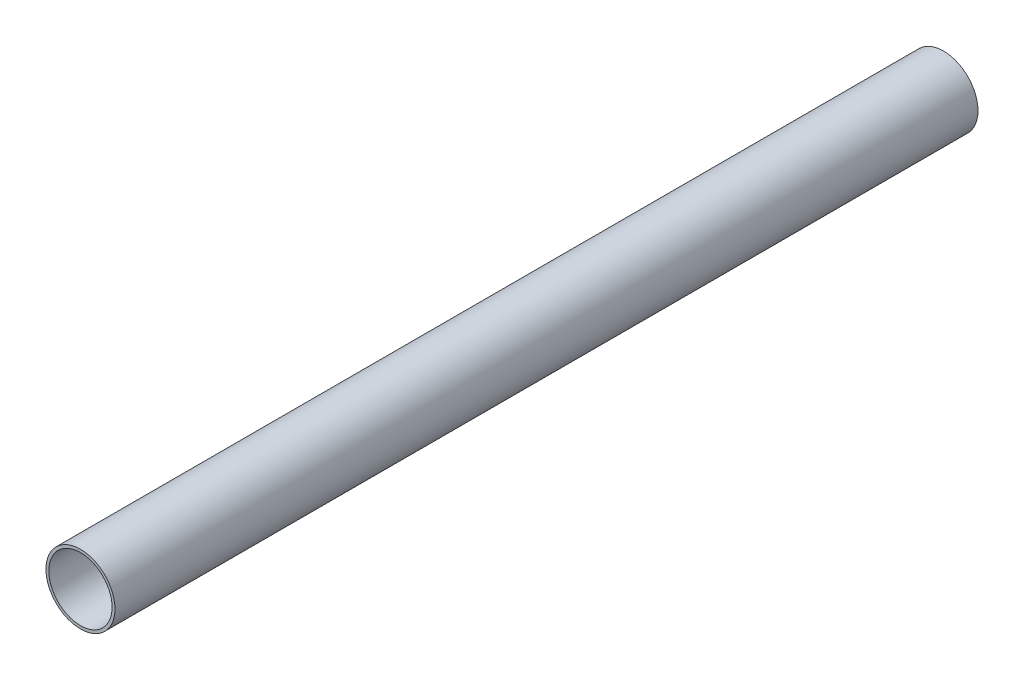
from build123d import *

# Parameters (mm, degrees)
SKETCH_1_R          = 3
EXTRUDE_1_DEPTH     = 75
SKETCH_2_R          = 2.75
CUT_EXTRUDE_1_DEPTH = 75


with BuildPart() as part:
    # 草图1 → 凸台-拉伸1 (new body)
    with BuildSketch(Plane.XY):
        Circle(SKETCH_1_R)
    extrude(amount=EXTRUDE_1_DEPTH)

    # 草图2 → 切除-拉伸1 (cut)
    with BuildSketch(Plane(origin=(0, 0, 0), x_dir=(-1, 0, 0), z_dir=(0, 0, -1))):
        Circle(SKETCH_2_R)
    extrude(amount=-CUT_EXTRUDE_1_DEPTH, mode=Mode.SUBTRACT)


solid = part.part
